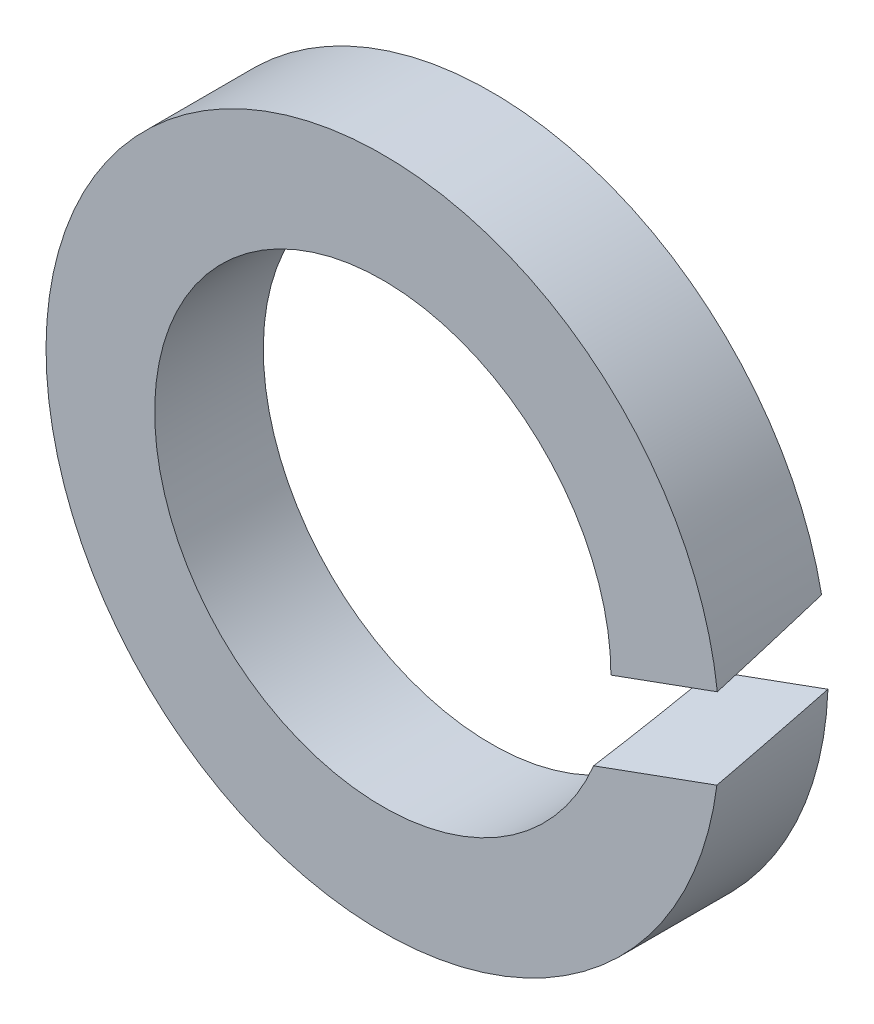
from build123d import *

# Parameters (mm, degrees)
SKETCH_1_W = 0.5
SKETCH_1_H = 0.5


with BuildPart() as part:
    # Эскиз1 → Revolve 170 (revolve)
    with BuildSketch(Plane(origin=(0, 0, 0), x_dir=(0, 0, -1), z_dir=(1, 0, 0))):
        with Locations((0.25, 1.3)):
            Rectangle(SKETCH_1_W, SKETCH_1_H)
    revolve(axis=Axis((0, 0, 0), (0, 0, -1)))

    # Вырез-По траектории1: sweep along a path in Эскиз3
    with BuildLine(Plane(origin=(0, 0, 0), x_dir=(0, 0, -1), z_dir=(1, 0, 0))) as sweep_1_path:
        Line((0, 0), (20, 5.358983849))
    # Эскиз2 → Вырез-По траектории1 (sweep, cut)
    with BuildSketch(Plane.XY):
        Polygon((0.850495409, -0.072613733), (1.95362449, 0.328892417), (2.07333154, 0), (0.970202459, -0.40150615), align=None)
    sweep(path=sweep_1_path.line, mode=Mode.SUBTRACT)


solid = part.part
